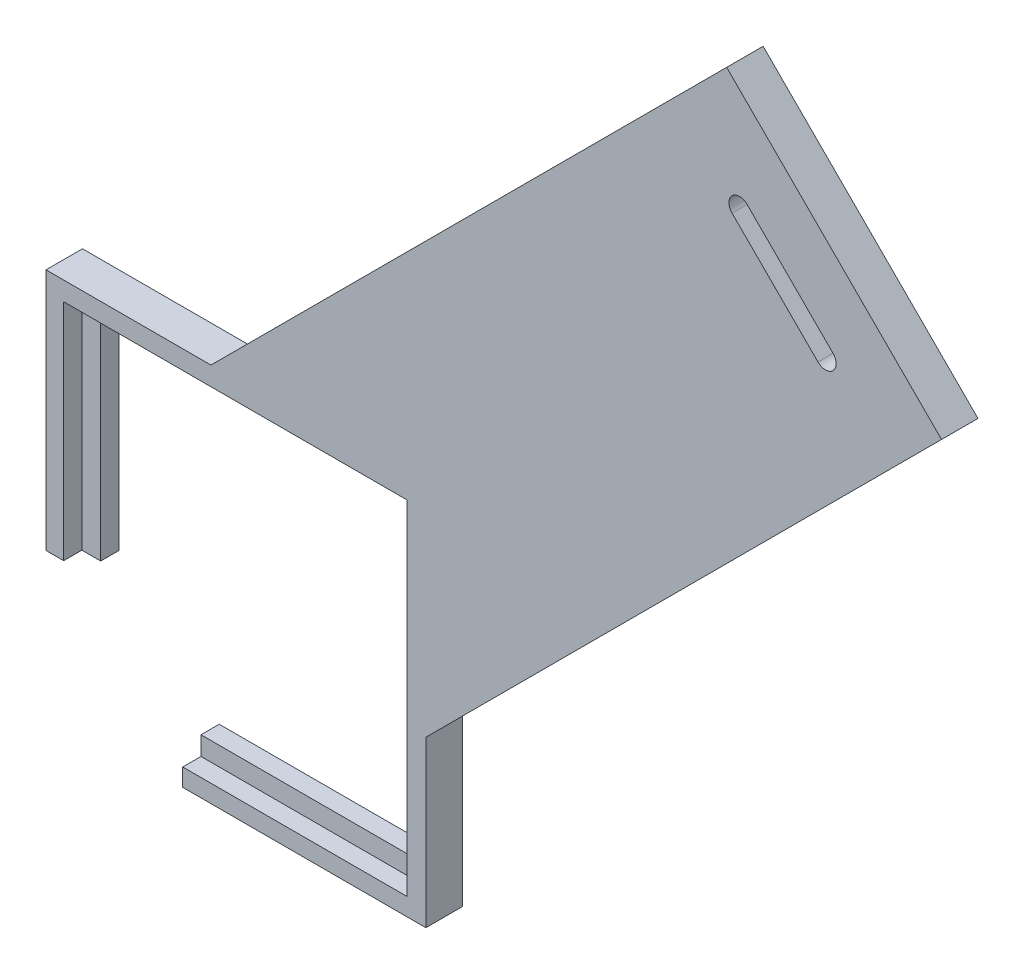
from build123d import *

# Parameters (mm, degrees)
EXTRUDE_1_DEPTH     = 6
SKETCH_2_W          = 56.5
SKETCH_2_H          = 56.5
CUT_EXTRUDE_1_DEPTH = 3
CUT_EXTRUDE_2_DEPTH = 6


with BuildPart() as part:
    # 草图1 → 凸台-拉伸1 (new body)
    with BuildSketch(Plane.XY):
        Polygon((22.5, 0), (62.5, 0), (62.5, 27.144660941), (147.352813742, 111.997474683), (111.997474683, 147.352813742), (27.144660941, 62.5), (0, 62.5), (0, 22.5), (6, 22.5), (6, 56.5), (56.5, 56.5), (56.5, 6), (22.5, 6), align=None)
    extrude(amount=EXTRUDE_1_DEPTH)

    # 草图2 → 切除-拉伸1 (cut)
    with BuildSketch(Plane.XY.offset(6)):
        with Locations((31.156538063, 31.156538063)):
            Rectangle(SKETCH_2_W, SKETCH_2_H)
    extrude(amount=-CUT_EXTRUDE_1_DEPTH, mode=Mode.SUBTRACT)

    # 草图3 → 切除-拉伸2 (cut)
    with BuildSketch(Plane.XY.offset(6)):
        with BuildLine():
            Line((112.88135816, 127.023493783), (127.023493783, 112.88135816))
            ThreePointArc((127.023493783, 112.88135816), (129.498367517, 112.88135816), (129.498367517, 115.356231894))
            Line((129.498367517, 115.356231894), (115.356231894, 129.498367517))
            ThreePointArc((115.356231894, 129.498367517), (112.88135816, 129.498367517), (112.88135816, 127.023493783))
        make_face()
    extrude(amount=-CUT_EXTRUDE_2_DEPTH, mode=Mode.SUBTRACT)


solid = part.part
